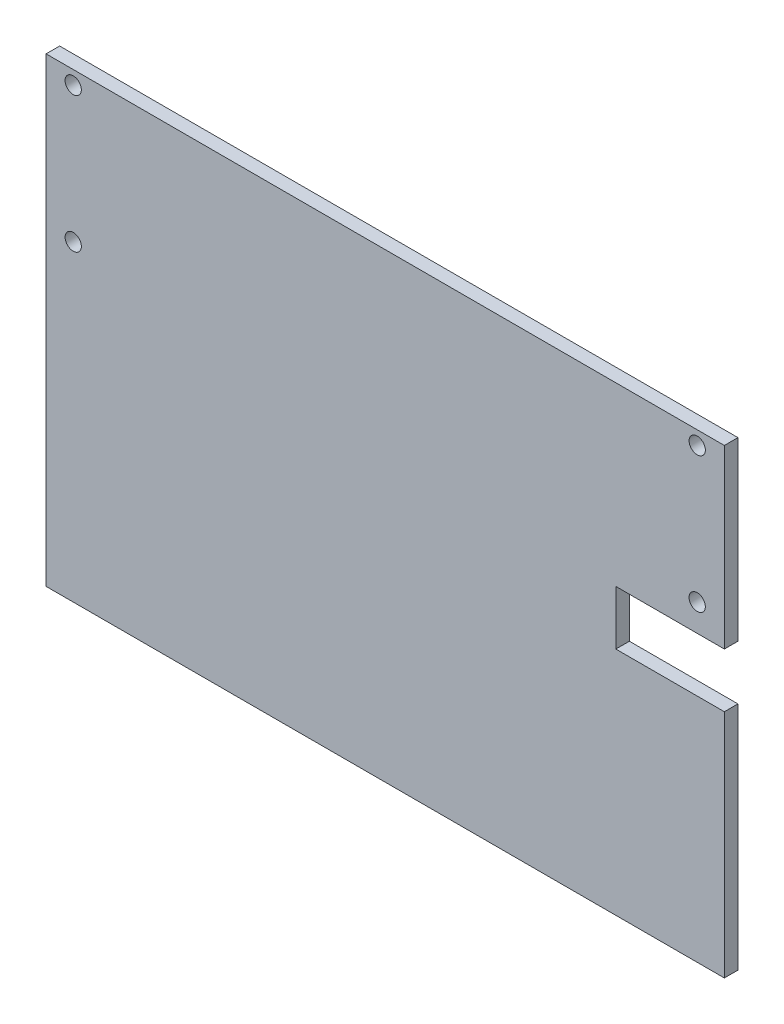
from build123d import *

# Parameters (mm, degrees)
ESQUISSE1_W             = 250
ESQUISSE1_H             = 170
ESQUISSE1_R             = 3
BOSS_EXTRU_1_DEPTH      = 5
ESQUISSE4_W             = 40
ESQUISSE4_H             = 20
ENL_V_MAT_EXTRU_1_DEPTH = 10


with BuildPart() as part:
    # Esquisse1 → Boss.-Extru.1 (new body)
    with BuildSketch(Plane.XY):
        with Locations((125, -85)):
            Rectangle(ESQUISSE1_W, ESQUISSE1_H)
        with Locations((10, -55)):
            Circle(ESQUISSE1_R, mode=Mode.SUBTRACT)
        with Locations((10, -5)):
            Circle(ESQUISSE1_R, mode=Mode.SUBTRACT)
        with Locations(Location((240, -55, 0), (0, 0, 180))):
            Circle(ESQUISSE1_R, mode=Mode.SUBTRACT)
        with Locations(Location((240, -5, 0), (0, 0, 180))):
            Circle(ESQUISSE1_R, mode=Mode.SUBTRACT)
    extrude(amount=BOSS_EXTRU_1_DEPTH)

    # Esquisse4 → Enlèv. mat.-Extru.1 (cut)
    with BuildSketch(Plane.XY.offset(5)):
        with Locations((230, -75)):
            Rectangle(ESQUISSE4_W, ESQUISSE4_H)
    extrude(amount=-ENL_V_MAT_EXTRU_1_DEPTH, mode=Mode.SUBTRACT)


solid = part.part
